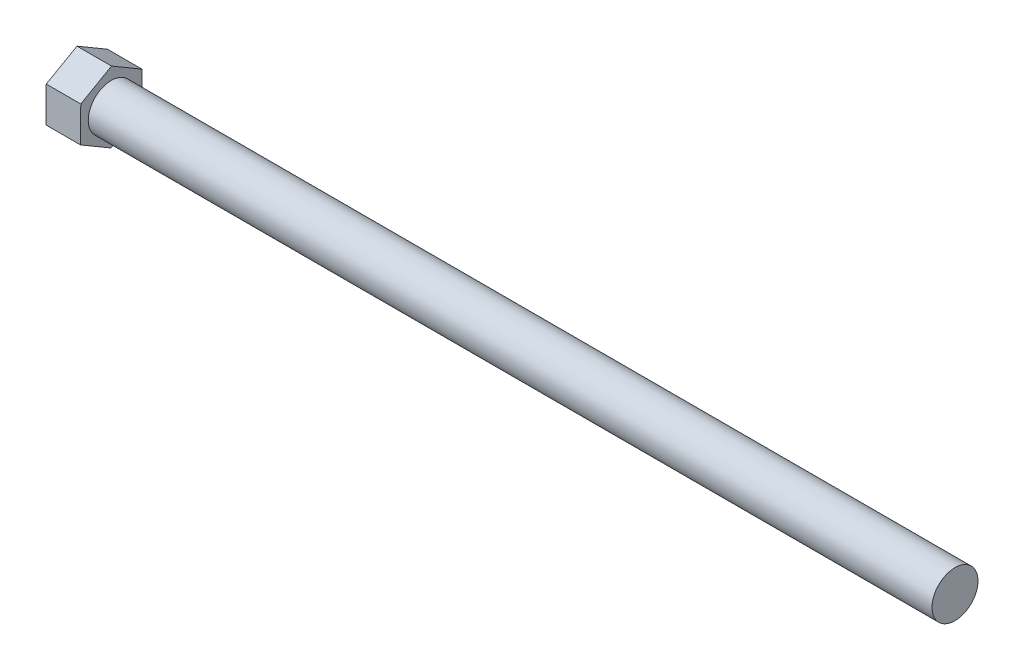
from build123d import *

# Parameters (mm, degrees)
SKETCH_1_R      = 6
EXTRUDE_1_DEPTH = 220
EXTRUDE_2_DEPTH = 9


with BuildPart() as part:
    # Эскиз1 → Бобышка-Вытянуть1 (new body)
    with BuildSketch(Plane(origin=(0, 0, 0), x_dir=(0, 0, -1), z_dir=(1, 0, 0))):
        Circle(SKETCH_1_R)
    extrude(amount=EXTRUDE_1_DEPTH)

    # Эскиз2 → Бобышка-Вытянуть2 (add)
    with BuildSketch(Plane.ZY):
        Polygon((8.014369071, -4.551055046), (7.948513819, 4.665119688), (-0.065855252, 9.216174734), (-8.014369071, 4.551055046), (-7.948513819, -4.665119688), (0.065855252, -9.216174734), align=None)
    extrude(amount=EXTRUDE_2_DEPTH)


solid = part.part
